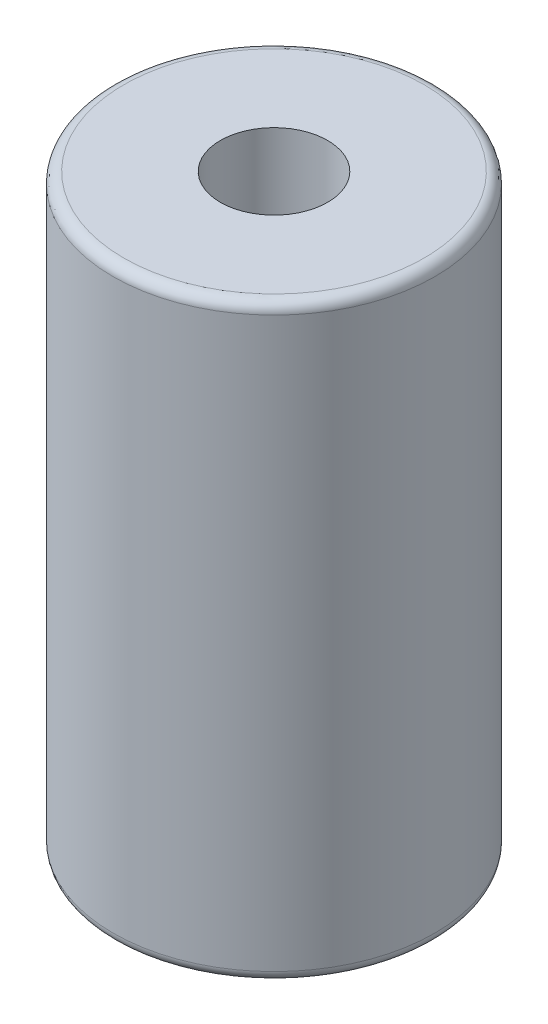
from build123d import *

# Parameters (mm, degrees)
SKETCH1_R           = 1.5
SKETCH1_R_2         = 0.5
BOSS_EXTRUDE1_DEPTH = 5.5
FILLET1_R           = 0.1


with BuildPart() as part:
    # Sketch1 → Boss-Extrude1 (new body)
    with BuildSketch(Plane(origin=(0, 0, 0), x_dir=(1, 0, 0), z_dir=(0, 1, 0))):
        with Locations(Location((0, 0, 0), (0, 0, 270))):
            Circle(SKETCH1_R)
        with Locations(Location((0, 0, 0), (0, 0, 270))):
            Circle(SKETCH1_R_2, mode=Mode.SUBTRACT)
    extrude(amount=BOSS_EXTRUDE1_DEPTH)

    # Fillet1
    fillet1_edges = [part.edges().sort_by_distance(p)[0] for p in [
        (0, 0, -1.5),
        (0, 5.5, -1.5),
    ]]
    fillet(fillet1_edges, radius=FILLET1_R)


solid = part.part
